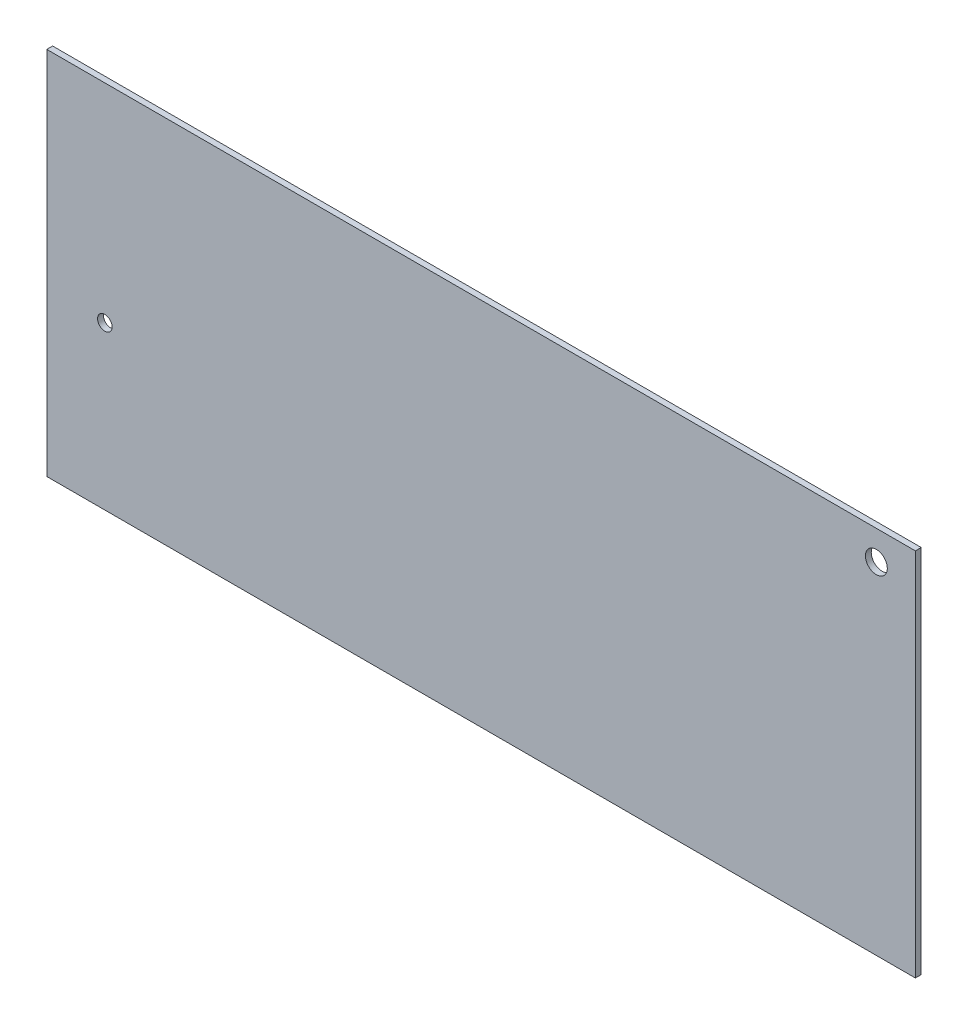
from build123d import *

# Parameters (mm, degrees)
SKETCH1_W           = 377.799442515
SKETCH1_H           = 160.906327865
BOSS_EXTRUDE1_DEPTH = 2.54
SKETCH2_R           = 4.7625
CUT_EXTRUDE1_DEPTH  = 283.285560089
SKETCH3_R           = 3.175
CUT_EXTRUDE2_DEPTH  = 283.285560089


with BuildPart() as part:
    # Sketch1 → Boss-Extrude1 (new body)
    with BuildSketch(Plane.XY):
        with Locations((-67.085990584, -38.500613509)):
            Rectangle(SKETCH1_W, SKETCH1_H)
    extrude(amount=BOSS_EXTRUDE1_DEPTH)

    # Sketch2 → Cut-Extrude1 (cut, through all)
    with BuildSketch(Plane(origin=(0, 0, 0), x_dir=(-1, 0, 0), z_dir=(0, 0, -1))):
        with Locations((-104.843972106, 29.252550423)):
            Circle(SKETCH2_R)
    extrude(amount=-CUT_EXTRUDE1_DEPTH, mode=Mode.SUBTRACT)

    # Sketch3 → Cut-Extrude2 (cut, through all)
    with BuildSketch(Plane(origin=(0, 0, 0), x_dir=(-1, 0, 0), z_dir=(0, 0, -1))):
        with Locations((230.736599113, -48.434957303)):
            Circle(SKETCH3_R)
    extrude(amount=-CUT_EXTRUDE2_DEPTH, mode=Mode.SUBTRACT)


solid = part.part
